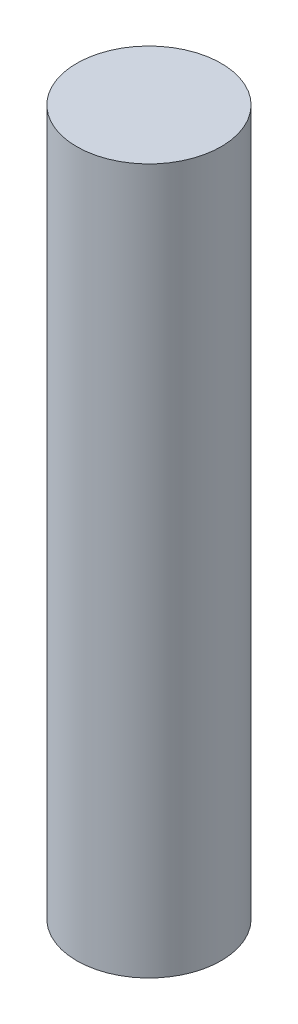
from build123d import *

# Parameters (mm, degrees)
BOSS_EXTRUDE1_DEPTH      = 77
BOSS_EXTRUDE1_DEPTH_BACK = 45
SKETCH1_R                = 12.5


with BuildPart() as part:
    # Sketch1 → Boss-Extrude1 (new, two sides: drawn at the far end of the back side and taken through both)
    with BuildSketch(Plane(origin=(0, 0, 0), x_dir=(1, 0, 0), z_dir=(0, 1, 0)).offset(-BOSS_EXTRUDE1_DEPTH_BACK)):
        with Locations(Location((0, 0, 0), (0, 0, 270))):
            Circle(SKETCH1_R)
    extrude(amount=BOSS_EXTRUDE1_DEPTH + BOSS_EXTRUDE1_DEPTH_BACK)


solid = part.part
